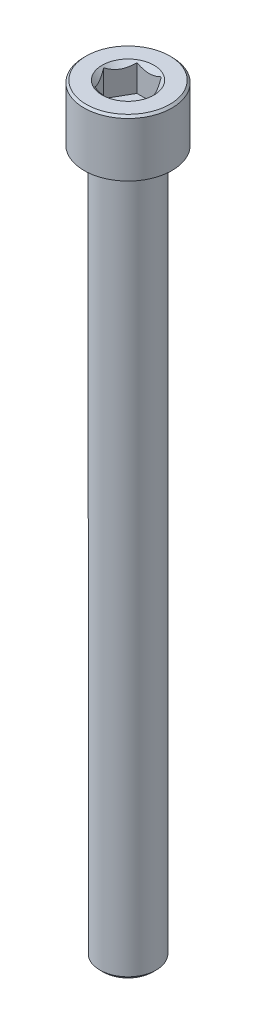
from build123d import *

# Parameters (mm, degrees)
WYCI_GNI_CIE1_DEPTH        = 4
SFAZOWANIE1_SIZE           = 0.3
SZKIC3_R                   = 3.68172134
WYTNIJ_WYCI_GNI_CIE1_DEPTH = 2
WYTNIJ_WYCI_GNI_CIE1_DRAFT = -45
SFAZOWANIE2_SIZE           = 0.5


with BuildPart() as part:
    # Szkic1 → Obrót1 (revolve)
    with BuildSketch(Plane.XY, mode=Mode.PRIVATE) as obr_t1_sk:
        Polygon((0, 0), (-4, 0), (-4, 100), (-6.25, 100), (-6.25, 108), (0, 108), align=None)
    revolve(obr_t1_sk.sketch.rotate(Axis((0, 0, 0), (0, 1, 0)), 270), axis=Axis((0, 0, 0), (0, 1, 0)))

    # Szkic2 → Wyciągnięcie1 (cut)
    with BuildSketch(Plane(origin=(0, 108, 0), x_dir=(1, 0, 0), z_dir=(0, 1, 0))):
        Polygon((3.464101615, 0), (1.732050808, 3), (-1.732050808, 3), (-3.464101615, 0), (-1.732050808, -3), (1.732050808, -3), align=None)
    extrude(amount=-WYCI_GNI_CIE1_DEPTH, mode=Mode.SUBTRACT)

    # Sfazowanie1
    sfazowanie1_edges = [part.edges().sort_by_distance(p)[0] for p in [
        (0, 108, 6.25),
    ]]
    chamfer(sfazowanie1_edges, length=SFAZOWANIE1_SIZE)


with BuildPart() as wytnij_wyci_gni_cie1_tool:
    # Szkic3 → Wytnij-wyciągnięcie1 (with draft: the straight prism first)
    with BuildSketch(Plane(origin=(0, 108, 0), x_dir=(1, 0, 0), z_dir=(0, 1, 0))):
        Circle(SZKIC3_R)
    extrude(amount=-WYTNIJ_WYCI_GNI_CIE1_DEPTH)
    # Wytnij-wyciągnięcie1: the draft: its side faces are tilted about the plane it starts from
    wytnij_wyci_gni_cie1_sides = [wytnij_wyci_gni_cie1_tool.faces().sort_by_distance(p)[0] for p in [
        (-3.68172134, 107, 0),
    ]]
    draft(wytnij_wyci_gni_cie1_sides, Plane(origin=(0, 108, 0), x_dir=(1, 0, 0), z_dir=(0, 1, 0)), WYTNIJ_WYCI_GNI_CIE1_DRAFT)


with BuildPart() as part_1:
    add(part.part)

    # Wytnij-wyciągnięcie1: cut by wytnij_wyci_gni_cie1_tool
    add(wytnij_wyci_gni_cie1_tool.part, mode=Mode.SUBTRACT)

    # Sfazowanie2
    sfazowanie2_edges = [part_1.edges().sort_by_distance(p)[0] for p in [
        (0, 0, 4),
    ]]
    chamfer(sfazowanie2_edges, length=SFAZOWANIE2_SIZE)


solid = part_1.part
